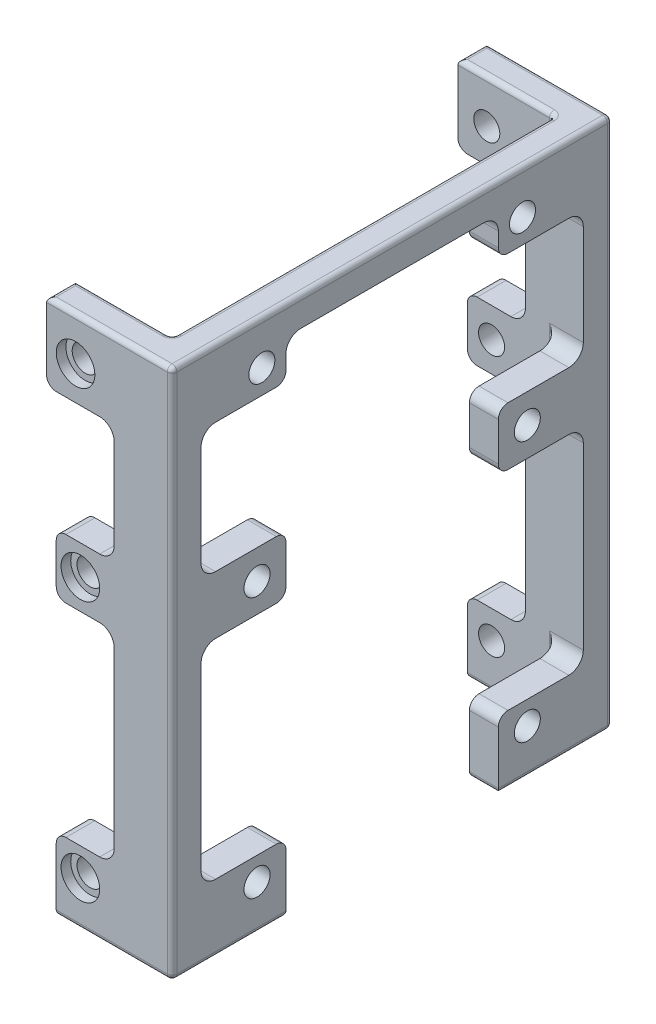
from build123d import *

# Parameters (mm, degrees)
BOSS_EXTRUDE1_DEPTH = 3
SKETCH3_W           = 3
SKETCH3_H           = 56
BOSS_EXTRUDE2_DEPTH = 8.8
SKETCH4_W           = 8.8
SKETCH4_H           = 21.6
SKETCH4_H_2         = 13.4
CUT_EXTRUDE1_DEPTH  = 31.699185657
SKETCH5_W           = 6
SKETCH5_H           = 21.02
SKETCH5_H_2         = 12.32
CUT_EXTRUDE2_DEPTH  = 31.971599894
SKETCH6_R           = 1.35
CUT_EXTRUDE3_DEPTH  = 31.971599894
SKETCH8_R           = 1.35
CUT_EXTRUDE5_DEPTH  = 32.708673892
SKETCH10_W          = 3
SKETCH10_H          = 3
BOSS_EXTRUDE3_DEPTH = 11
SKETCH11_W          = 3
SKETCH11_H          = 8
BOSS_EXTRUDE4_DEPTH = 1
SKETCH12_W          = 12
SKETCH12_H          = 45.6
CUT_EXTRUDE6_DEPTH  = 1
FILLET1_R           = 1
FILLET2_R           = 1.5
FILLET3_R           = 0.5
SKETCH13_R          = 2
CUT_EXTRUDE7_DEPTH  = 1
SKETCH14_R          = 2
CUT_EXTRUDE8_DEPTH  = 1


with BuildPart() as part:
    # Sketch2 → Boss-Extrude1 (new body)
    with BuildSketch(Plane.XY):
        Polygon((-6, -15.966065264), (-6, 28), (6, 28), (6, -28), (-6, -28), align=None)
    extrude(amount=BOSS_EXTRUDE1_DEPTH)

    # Sketch3 → Boss-Extrude2 (add)
    with BuildSketch(Plane(origin=(0, 0, 0), x_dir=(-1, 0, 0), z_dir=(0, 0, -1))):
        with Locations((-4.5, 0)):
            Rectangle(SKETCH3_W, SKETCH3_H)
    extrude(amount=BOSS_EXTRUDE2_DEPTH)

    # Sketch4 → Cut-Extrude1 (cut, through all)
    with BuildSketch(Plane.ZY.offset(-3)):
        with Locations((-4.4, -9.2)):
            Rectangle(SKETCH4_W, SKETCH4_H)
        with Locations((-4.4, 14.3)):
            Rectangle(SKETCH4_W, SKETCH4_H_2)
    extrude(amount=-CUT_EXTRUDE1_DEPTH, mode=Mode.SUBTRACT)

    # Sketch5 → Cut-Extrude2 (cut, through all)
    with BuildSketch(Plane.XY.offset(3)):
        with Locations((-3, -8.99)):
            Rectangle(SKETCH5_W, SKETCH5_H)
        with Locations((-3, 13.84)):
            Rectangle(SKETCH5_W, SKETCH5_H_2)
    extrude(amount=-CUT_EXTRUDE2_DEPTH, mode=Mode.SUBTRACT)

    # Sketch6 → Cut-Extrude3 (cut, through all)
    with BuildSketch(Plane.XY.offset(3)):
        with Locations((-4, 23.5)):
            Circle(SKETCH6_R)
        with Locations((-3.5, 4.6)):
            Circle(SKETCH6_R)
        with Locations((-3.5, -22.4)):
            Circle(SKETCH6_R)
    extrude(amount=-CUT_EXTRUDE3_DEPTH, mode=Mode.SUBTRACT)

    # Sketch8 → Cut-Extrude5 (cut, through all)
    with BuildSketch(Plane(origin=(6, 0, 0), x_dir=(0, 0, -1), z_dir=(1, 0, 0))):
        with Locations((6.3, 23.5)):
            Circle(SKETCH8_R)
        with Locations((5.8, 4.6)):
            Circle(SKETCH8_R)
        with Locations((5.8, -22.4)):
            Circle(SKETCH8_R)
    extrude(amount=-CUT_EXTRUDE5_DEPTH, mode=Mode.SUBTRACT)

    # Sketch10 → Boss-Extrude3 (add)
    with BuildSketch(Plane(origin=(0, 0, -8.8), x_dir=(-1, 0, 0), z_dir=(0, 0, -1))):
        with Locations((-4.5, 26.5)):
            Rectangle(SKETCH10_W, SKETCH10_H)
    extrude(amount=BOSS_EXTRUDE3_DEPTH)

    # Mirror3: part across plane


with BuildPart() as part_1:
    add(part.part)
    add(part.part.mirror(Plane(origin=(0, 0, -19.8), x_dir=(1, 0, 0), z_dir=(0, 0, -1))))

    # Sketch11 → Boss-Extrude4 (add)
    with BuildSketch(Plane.ZY.offset(6)):
        with Locations((1.5, 24)):
            Rectangle(SKETCH11_W, SKETCH11_H)
        with Locations((-41.1, 24)):
            Rectangle(SKETCH11_W, SKETCH11_H)
    extrude(amount=BOSS_EXTRUDE4_DEPTH)

    # Sketch12 → Cut-Extrude6 (cut)
    with BuildSketch(Plane.XZ.offset(28)):
        with Locations((0, -19.8)):
            Rectangle(SKETCH12_W, SKETCH12_H)
    extrude(amount=-CUT_EXTRUDE6_DEPTH, mode=Mode.SUBTRACT)

    # Fillet1
    fillet1_edges = [part_1.edges().sort_by_distance(p)[0] for p in [
        (-6, 7.68, -41.1),
        (4.5, 7.6, -30.8),
        (-6, -19.5, -41.1),
        (4.5, -20, -30.8),
        (4.5, 21, -30.8),
        (4.5, 1.6, -30.8),
        (-6, 1.52, -41.1),
        (-7, 20, 1.5),
        (-7, 20, -41.1),
        (4.5, -20, -8.8),
        (4.5, 1.6, -8.8),
        (4.5, 7.6, -8.8),
        (4.5, 21, -8.8),
        (-6, -19.5, 1.5),
        (-6, 1.52, 1.5),
        (-6, 7.68, 1.5),
    ]]
    fillet(fillet1_edges, radius=FILLET1_R)

    # Fillet2
    fillet2_edges = [part_1.edges().sort_by_distance(p)[0] for p in [
        (4.5, 25, -8.8),
        (4.5, 25, -30.8),
        (4.5, 1.6, -39.6),
        (4.5, 21, -39.6),
        (4.5, 7.6, -39.6),
        (4.5, -20, -39.6),
        (0, 20, -41.1),
        (0, 7.68, -41.1),
        (0, 1.52, -41.1),
        (0, -19.5, -41.1),
        (4.5, 1.6, 0),
        (4.5, -20, 0),
        (4.5, 21, 0),
        (4.5, 7.6, 0),
        (0, 1.52, 1.5),
        (0, -19.5, 1.5),
        (0, 20, 1.5),
        (0, 7.68, 1.5),
    ]]
    fillet(fillet2_edges, radius=FILLET2_R)

    # Fillet3
    fillet3_edges = [part_1.edges().sort_by_distance(p)[0] for p in [
        (-0.5, 28, -42.6),
        (3, 4.6, -39.6),
        (3, 23.75, -39.6),
        (-2, 28, -39.6),
        (-2, 28, 0),
        (3, 28, -19.8),
        (-7, 28, 1.5),
        (-7, 28, -41.1),
        (4.5, -27, -30.8),
        (3, -22.75, -39.6),
        (6, 0.5, -42.6),
        (3, -22.75, 0),
        (6, 0.5, 3),
        (-6, -27, 1.5),
        (6, -27, -2.9),
        (3, -27, -4.4),
        (3, -27, -35.2),
        (-1.5, -27, 0),
        (4.5, -27, -8.8),
        (6, -27, -36.7),
        (0, -27, -42.6),
        (-6, -27, -41.1),
        (0, -27, 3),
        (-1.5, -27, -39.6),
        (3, 4.6, 0),
        (3, 23.75, 0),
        (-0.5, 28, 3),
        (6, 28, -19.8),
    ]]
    fillet(fillet3_edges, radius=FILLET3_R)

    # Sketch13 → Cut-Extrude7 (cut)
    with BuildSketch(Plane.ZY.offset(-3)):
        with Locations(Location((-33.3, 23.5, 0), (0, 0, 270))):
            Circle(SKETCH13_R)
        with Locations(Location((-33.8, 4.6, 0), (0, 0, 270))):
            Circle(SKETCH13_R)
        with Locations(Location((-33.8, -22.4, 0), (0, 0, 270))):
            Circle(SKETCH13_R)
        with Locations(Location((-5.8, -22.4, 0), (0, 0, 90))):
            Circle(SKETCH13_R)
        with Locations(Location((-5.8, 4.6, 0), (0, 0, 90))):
            Circle(SKETCH13_R)
        with Locations(Location((-6.3, 23.5, 0), (0, 0, 90))):
            Circle(SKETCH13_R)
    extrude(amount=-CUT_EXTRUDE7_DEPTH, mode=Mode.SUBTRACT)

    # Sketch14 → Cut-Extrude8 (cut)
    with BuildSketch(Plane(origin=(0, 0, -42.6), x_dir=(-1, 0, 0), z_dir=(0, 0, -1))):
        with Locations((4, 23.5)):
            Circle(SKETCH14_R)
        with Locations((3.5, 4.6)):
            Circle(SKETCH14_R)
        with Locations((3.5, -22.4)):
            Circle(SKETCH14_R)
    cut_extrude8 = extrude(amount=-CUT_EXTRUDE8_DEPTH, mode=Mode.SUBTRACT)

    # Mirror4: Cut-Extrude8 across plane
    add(cut_extrude8.mirror(Plane(origin=(0, 0, -19.8), x_dir=(1, 0, 0), z_dir=(0, 0, -1))), mode=Mode.SUBTRACT)


solid = part_1.part
